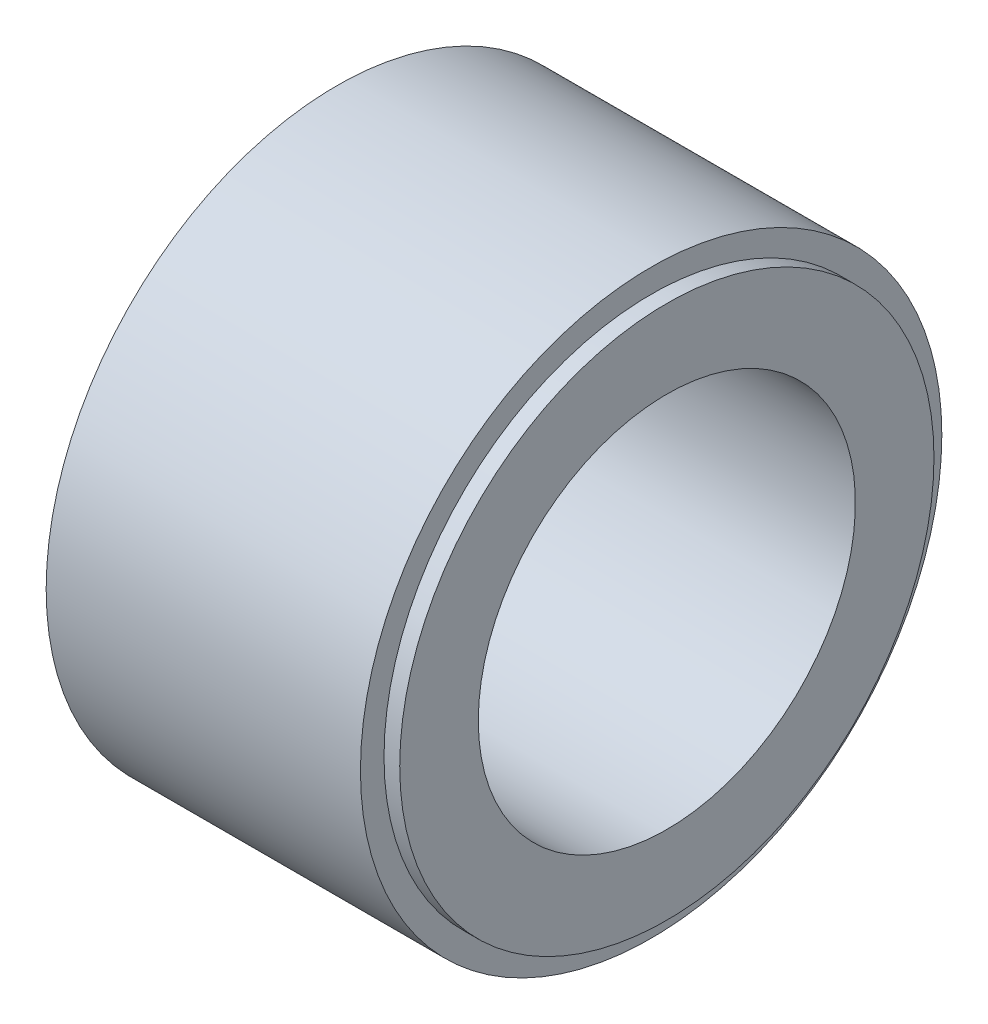
from build123d import *

# Parameters (mm, degrees)
SKETCH3_R           = 24
SKETCH3_R_2         = 4
SKETCH3_R_3         = 3
BOSS_EXTRUDE1_DEPTH = 4


with BuildPart() as part:
    # Sketch1 → Revolve2 (revolve)
    with BuildSketch(Plane.XY, mode=Mode.PRIVATE) as revolve2_sk:
        Polygon((0, 24), (0, 34), (2, 34), (2, 30), (42, 30), (42, 34), (44, 34), (44, 24), align=None)
    revolve(revolve2_sk.sketch.rotate(Axis((0, 0, 0), (1, 0, 0)), 90), axis=Axis((0, 0, 0), (1, 0, 0)))

    # Sketch2 → Revolve3 (revolve)
    with BuildSketch(Plane.XY, mode=Mode.PRIVATE) as revolve3_sk:
        Polygon((2, 34), (2, 30), (42, 30), (42, 34), (42, 37), (2, 37), align=None)
    revolve(revolve3_sk.sketch.rotate(Axis((0, 0, 0), (1, 0, 0)), 90), axis=Axis((0, 0, 0), (1, 0, 0)))

    # Sketch3 → Boss-Extrude1 (add)
    with BuildSketch(Plane.ZY):
        Circle(SKETCH3_R)
        with Locations((19, 0)):
            Circle(SKETCH3_R_2, mode=Mode.SUBTRACT)
        Circle(SKETCH3_R_3, mode=Mode.SUBTRACT)
        with Locations((9.5, -16.454482672)):
            Circle(SKETCH3_R_2, mode=Mode.SUBTRACT)
        with Locations((-9.5, -16.454482672)):
            Circle(SKETCH3_R_2, mode=Mode.SUBTRACT)
        with Locations((-19, 0)):
            Circle(SKETCH3_R_2, mode=Mode.SUBTRACT)
        with Locations((-9.5, 16.454482672)):
            Circle(SKETCH3_R_2, mode=Mode.SUBTRACT)
        with Locations((9.5, 16.454482672)):
            Circle(SKETCH3_R_2, mode=Mode.SUBTRACT)
    extrude(amount=-BOSS_EXTRUDE1_DEPTH)


solid = part.part
